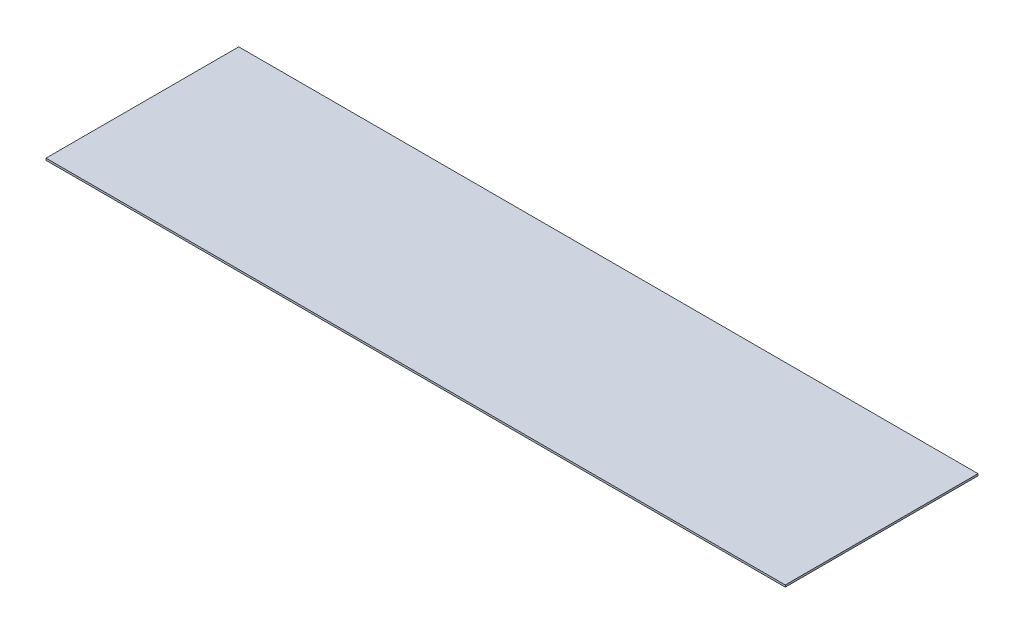
from build123d import *

# Parameters (mm, degrees)
SKETCH1_W           = 1212.85
SKETCH1_H           = 316.23
BOSS_EXTRUDE1_DEPTH = 3.175


with BuildPart() as part:
    # Sketch1 → Boss-Extrude1 (new body)
    with BuildSketch(Plane(origin=(0, 0, 0), x_dir=(1, 0, 0), z_dir=(0, 1, 0))):
        with Locations((606.425, 158.115)):
            Rectangle(SKETCH1_W, SKETCH1_H)
    extrude(amount=BOSS_EXTRUDE1_DEPTH)


solid = part.part
